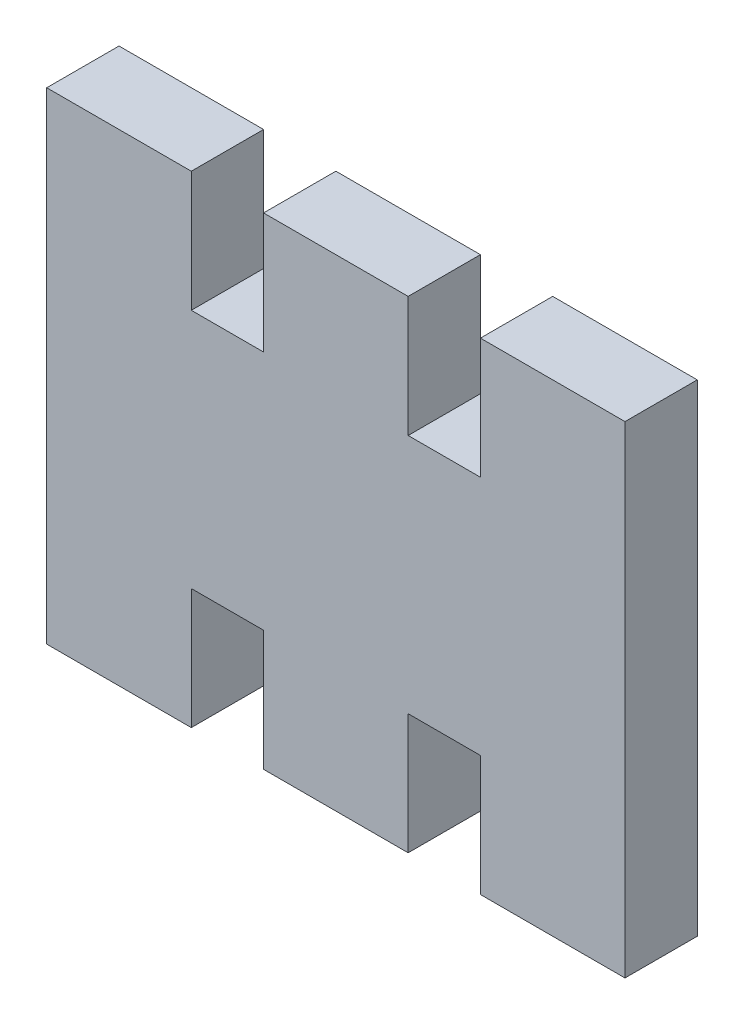
from build123d import *

# Parameters (mm, degrees)
SKETCH1_W            = 48
SKETCH1_H            = 40
BOSS_EXTRUDE1_DEPTH  = 6
SKETCH2_W            = 6
SKETCH2_H            = 10
CUT_EXTRUDE1_DEPTH   = 63.769419306
LPATTERN1_COUNT      = 2
LPATTERN1_PITCH      = 18
LPATTERN1_COUNT_DIR2 = 2
LPATTERN1_PITCH_DIR2 = 30


with BuildPart() as part:
    # Sketch1 → Boss-Extrude1 (new body)
    with BuildSketch(Plane.XY):
        with Locations((-24, 20)):
            Rectangle(SKETCH1_W, SKETCH1_H)
    extrude(amount=BOSS_EXTRUDE1_DEPTH)

    # Sketch2 → Cut-Extrude1 (cut, through all)
    with BuildSketch(Plane.XY.offset(6)):
        with Locations((-33, 35)):
            Rectangle(SKETCH2_W, SKETCH2_H)
    cut_extrude1 = extrude(amount=-CUT_EXTRUDE1_DEPTH, mode=Mode.SUBTRACT)

    # LPattern1: Cut-Extrude1 2 × 2
    with Locations(*[(i * LPATTERN1_PITCH, -j * LPATTERN1_PITCH_DIR2, 0) for i in range(LPATTERN1_COUNT) for j in range(LPATTERN1_COUNT_DIR2) if (i, j) != (0, 0)]):
        add(cut_extrude1, mode=Mode.SUBTRACT)


solid = part.part
